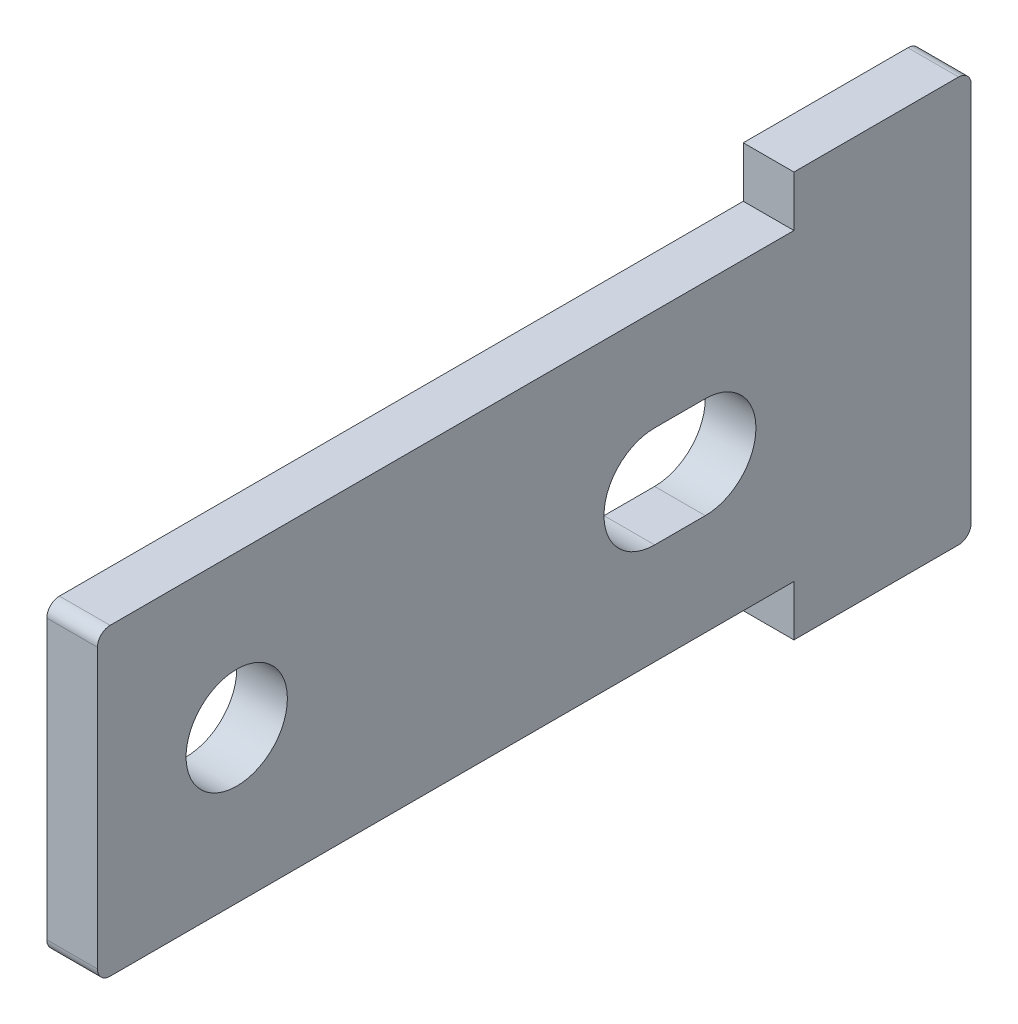
from build123d import *

# Parameters (mm, degrees)
BOSS_EXTRUDE1_DEPTH = 2
FILLET1_R           = 0.5
SKETCH2_R           = 2
CUT_EXTRUDE1_DEPTH  = 2


with BuildPart() as part:
    # Sketch1 → Boss-Extrude1 (new body)
    with BuildSketch(Plane.YZ):
        Polygon((0, 0), (8, 0), (8, 7), (6, 7), (6, 34.5), (-6, 34.5), (-6, 7), (-8, 7), (-8, 0), align=None)
    extrude(amount=BOSS_EXTRUDE1_DEPTH)

    # Fillet1
    fillet1_edges = [part.edges().sort_by_distance(p)[0] for p in [
        (1, 6, 34.5),
        (1, 8, 0),
        (1, -8, 0),
        (1, -6, 34.5),
    ]]
    fillet(fillet1_edges, radius=FILLET1_R)

    # Sketch2 → Cut-Extrude1 (cut)
    with BuildSketch(Plane.YZ.offset(2)):
        with Locations(Location((0, 29, 0), (0, 0, 270))):
            Circle(SKETCH2_R)
        with BuildLine():
            Line((-2, 12.5), (-2, 10.5))
            ThreePointArc((-2, 10.5), (0, 8.5), (2, 10.5))
            Line((2, 10.5), (2, 12.5))
            ThreePointArc((2, 12.5), (0, 14.5), (-2, 12.5))
        make_face()
    extrude(amount=-CUT_EXTRUDE1_DEPTH, mode=Mode.SUBTRACT)


solid = part.part
